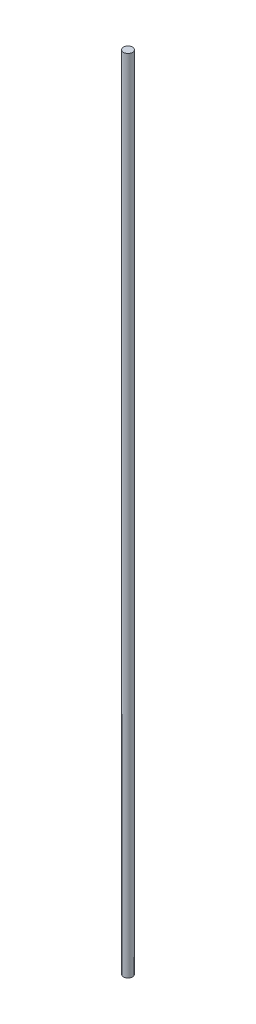
from build123d import *

# Parameters (mm, degrees)
SKETCH1_R           = 4
BOSS_EXTRUDE1_DEPTH = 700


with BuildPart() as part:
    # Sketch1 → Boss-Extrude1 (new body)
    with BuildSketch(Plane(origin=(0, 0, 0), x_dir=(1, 0, 0), z_dir=(0, 1, 0))):
        with Locations(Location((0, 0, 0), (0, 0, 270))):
            Circle(SKETCH1_R)
    extrude(amount=BOSS_EXTRUDE1_DEPTH)


solid = part.part
